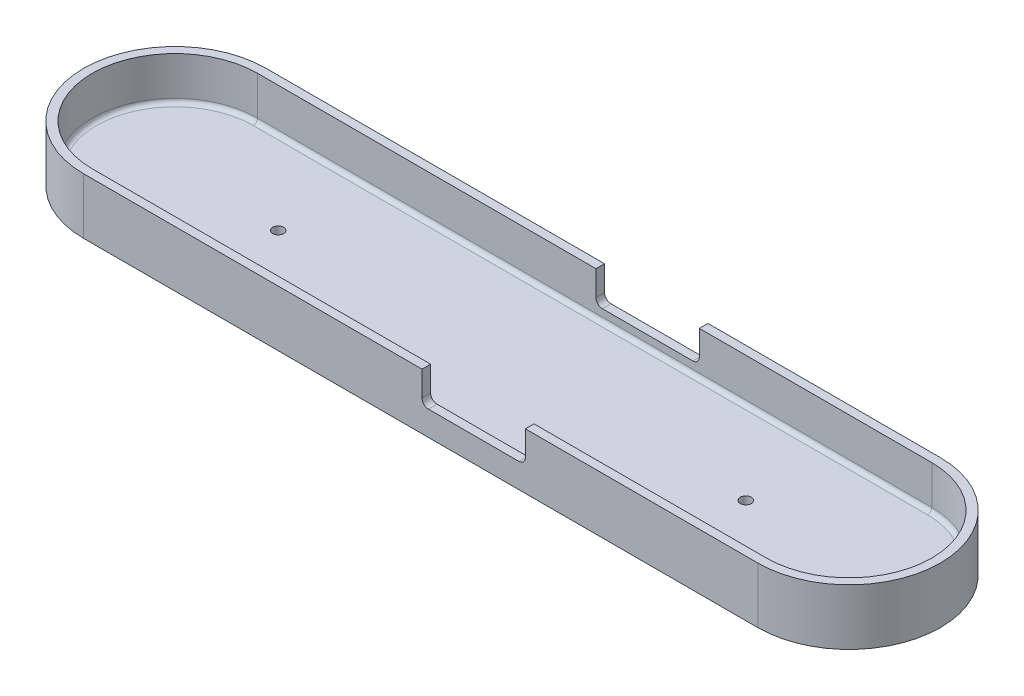
from build123d import *

# Parameters (mm, degrees)
MAINBLOCK_DEPTH               = 3.81
BOSS_EXTRUDE1_DEPTH           = 16.51
SKETCH3_R                     = 1.6256
CUT_EXTRUDE1_DEPTH            = 131.252044518
FILLET1_R                     = 1.27
SKETCH4_W                     = 30.48
SKETCH4_H                     = 2.54
STABILIZER_MOUNT_CUTOUT_DEPTH = 9.271
FILLET2_R                     = 1.905


with BuildPart() as part:
    # Sketch1 → MainBlock (new body)
    with BuildSketch(Plane(origin=(0, 0, 0), x_dir=(1, 0, 0), z_dir=(0, 1, 0))):
        with BuildLine():
            Line((-99.441, 24.384), (99.441, 24.384))
            ThreePointArc((99.441, 24.384), (123.825, 0), (99.441, -24.384))
            Line((99.441, -24.384), (-99.441, -24.384))
            ThreePointArc((-99.441, -24.384), (-123.825, 0), (-99.441, 24.384))
        make_face()
    extrude(amount=MAINBLOCK_DEPTH)

    # Sketch2 → Boss-Extrude1 (add)
    with BuildSketch(Plane.XZ):
        with BuildLine():
            Line((-99.441, 26.924), (99.441, 26.924))
            ThreePointArc((99.441, 26.924), (126.365, 0), (99.441, -26.924))
            Line((99.441, -26.924), (-99.441, -26.924))
            ThreePointArc((-99.441, -26.924), (-126.365, 0), (-99.441, 26.924))
        make_face()
        with BuildLine():
            Line((99.441, 24.384), (-99.441, 24.384))
            ThreePointArc((-99.441, 24.384), (-123.825, 0), (-99.441, -24.384))
            Line((-99.441, -24.384), (99.441, -24.384))
            ThreePointArc((99.441, -24.384), (123.825, 0), (99.441, 24.384))
        make_face(mode=Mode.SUBTRACT)
    extrude(amount=-BOSS_EXTRUDE1_DEPTH)

    # Sketch3 → Cut-Extrude1 (cut, through all)
    with BuildSketch(Plane.XZ):
        with Locations(Location((-68.961, 0, 0), (0, 0, 270))):
            Circle(SKETCH3_R)
        with Locations(Location((68.961, 0, 0), (0, 0, 270))):
            Circle(SKETCH3_R)
    extrude(amount=-CUT_EXTRUDE1_DEPTH, mode=Mode.SUBTRACT)

    # Fillet1
    fillet1_edges = [part.edges().sort_by_distance(p)[0] for p in [
        (123.825, 3.81, 0),
        (0, 3.81, -24.384),
        (-123.825, 3.81, 0),
        (0, 3.81, 24.384),
    ]]
    fillet(fillet1_edges, radius=FILLET1_R)

    # Sketch4 → Stabilizer-Mount-Cutout (cut)
    with BuildSketch(Plane(origin=(0, 16.51, 0), x_dir=(1, 0, 0), z_dir=(0, 1, 0))):
        with Locations((15.621, 25.654)):
            Rectangle(SKETCH4_W, SKETCH4_H)
    stabilizer_mount_cutout = extrude(amount=-STABILIZER_MOUNT_CUTOUT_DEPTH, mode=Mode.SUBTRACT)

    # Mirror1: Stabilizer-Mount-Cutout across plane
    add(stabilizer_mount_cutout.mirror(Plane.XY), mode=Mode.SUBTRACT)

    # Fillet2
    fillet2_edges = [part.edges().sort_by_distance(p)[0] for p in [
        (30.861, 7.239, -25.654),
        (0.381, 7.239, -25.654),
        (0.381, 7.239, 25.654),
        (30.861, 7.239, 25.654),
    ]]
    fillet(fillet2_edges, radius=FILLET2_R)


solid = part.part
